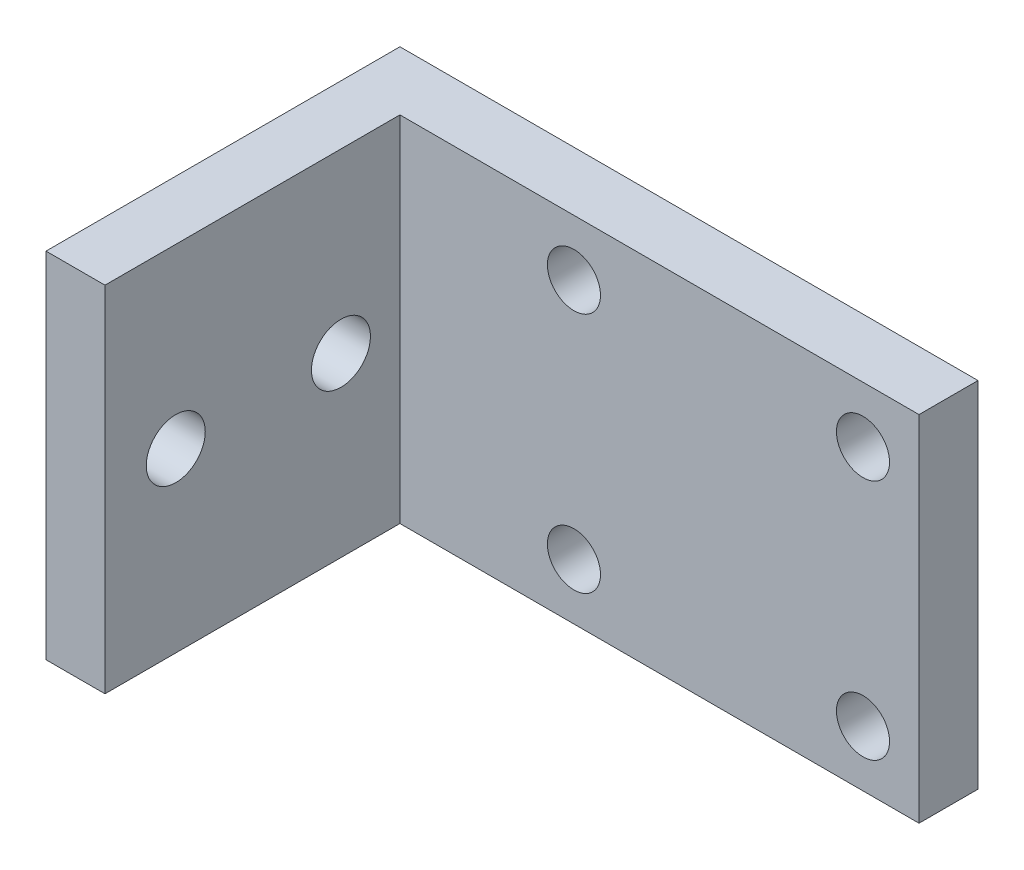
from build123d import *

# Parameters (mm, degrees)
SKETCH1_W           = 34
SKETCH1_H           = 30
SKETCH1_R           = 2.25
BOSS_EXTRUDE1_DEPTH = 5
SKETCH2_W           = 5
SKETCH2_H           = 30
BOSS_EXTRUDE2_DEPTH = 15
SKETCH4_W           = 5
SKETCH4_H           = 30
BOSS_EXTRUDE3_DEPTH = 25
SKETCH5_R           = 2.5
CUT_EXTRUDE1_DEPTH  = 25


with BuildPart() as part:
    # Sketch1 → Boss-Extrude1 (new body)
    with BuildSketch(Plane.XY):
        with Locations((17, 15)):
            Rectangle(SKETCH1_W, SKETCH1_H)
        with Locations((4.75, 25.25)):
            Circle(SKETCH1_R, mode=Mode.SUBTRACT)
        with Locations((29.25, 25.25)):
            Circle(SKETCH1_R, mode=Mode.SUBTRACT)
        with Locations((29.25, 4.75)):
            Circle(SKETCH1_R, mode=Mode.SUBTRACT)
        with Locations((4.75, 4.75)):
            Circle(SKETCH1_R, mode=Mode.SUBTRACT)
    extrude(amount=BOSS_EXTRUDE1_DEPTH)

    # Sketch2 → Boss-Extrude2 (add)
    with BuildSketch(Plane.ZY):
        with Locations((2.5, 15)):
            Rectangle(SKETCH2_W, SKETCH2_H)
    extrude(amount=BOSS_EXTRUDE2_DEPTH)

    # Sketch4 → Boss-Extrude3 (add)
    with BuildSketch(Plane.XY.offset(5)):
        with Locations((-12.5, 15)):
            Rectangle(SKETCH4_W, SKETCH4_H)
    extrude(amount=BOSS_EXTRUDE3_DEPTH)

    # Sketch5 → Cut-Extrude1 (cut)
    with BuildSketch(Plane(origin=(-10, 0, 0), x_dir=(0, 0, -1), z_dir=(1, 0, 0))):
        with Locations((-24, 15)):
            Circle(SKETCH5_R)
        with Locations((-10, 15)):
            Circle(SKETCH5_R)
    extrude(amount=-CUT_EXTRUDE1_DEPTH, mode=Mode.SUBTRACT)


solid = part.part
